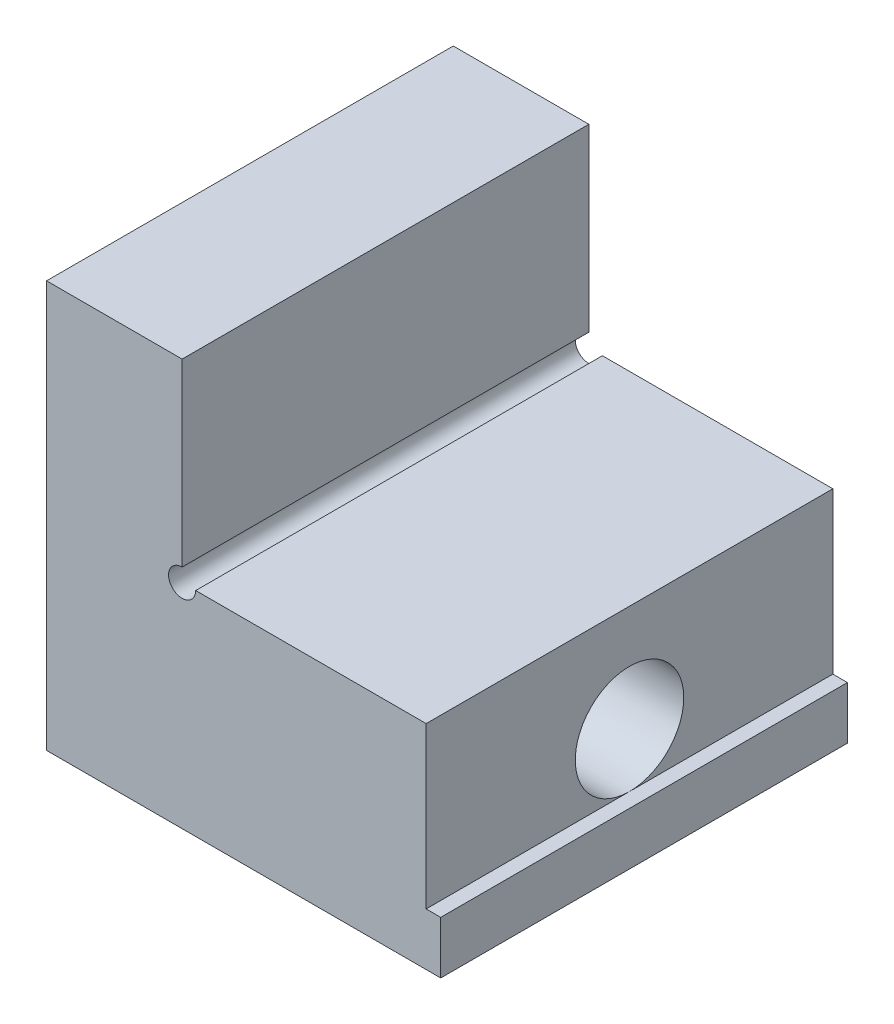
from build123d import *

# Parameters (mm, degrees)
BOSS_EXTRUDE1_DEPTH      = 15
BOSS_EXTRUDE1_DEPTH_BACK = 15
CUT_EXTRUDE1_DEPTH       = 55.4
CUT_EXTRUDE1_DEPTH_BACK  = 30
SKETCH2_R                = 4
SKETCH3_R                = 6.5
CUT_EXTRUDE2_DEPTH       = 18.2


with BuildPart() as part:
    # Sketch1 → Boss-Extrude1 (new, two sides: drawn at the far end of the back side and taken through both)
    with BuildSketch(Plane.XY.offset(-BOSS_EXTRUDE1_DEPTH_BACK)):
        with BuildLine():
            Line((-10, 14.285038976), (-10, -15.714961024))
            Line((-10, -15.714961024), (19.0754, -15.714961024))
            Line((19.0754, -15.714961024), (19.0754, -11.84))
            Line((19.0754, -11.84), (18, -11.84))
            Line((18, -11.84), (18, 0))
            Line((18, 0), (1, 0))
            ThreePointArc((1, 0), (-0.707106781, -0.707106781), (0, 1))
            Line((0, 1), (0, 14.285038976))
            Line((0, 14.285038976), (-10, 14.285038976))
        make_face()
    extrude(amount=BOSS_EXTRUDE1_DEPTH + BOSS_EXTRUDE1_DEPTH_BACK)

    # Sketch2 → Cut-Extrude1 (cut, two sides: drawn at the far end of the back side and taken through both)
    with BuildSketch(Plane(origin=(0, 0, 0), x_dir=(0, 0, -1), z_dir=(1, 0, 0)).offset(-CUT_EXTRUDE1_DEPTH_BACK)):
        with Locations((0, -7.84)):
            Circle(SKETCH2_R)
    extrude(amount=CUT_EXTRUDE1_DEPTH + CUT_EXTRUDE1_DEPTH_BACK, mode=Mode.SUBTRACT)

    # Sketch3 → Cut-Extrude2 (cut)
    with BuildSketch(Plane(origin=(0, 0, 0), x_dir=(0, 0, -1), z_dir=(1, 0, 0))):
        with Locations((0, -7.84)):
            Circle(SKETCH3_R)
    extrude(amount=-CUT_EXTRUDE2_DEPTH, mode=Mode.SUBTRACT)


solid = part.part
